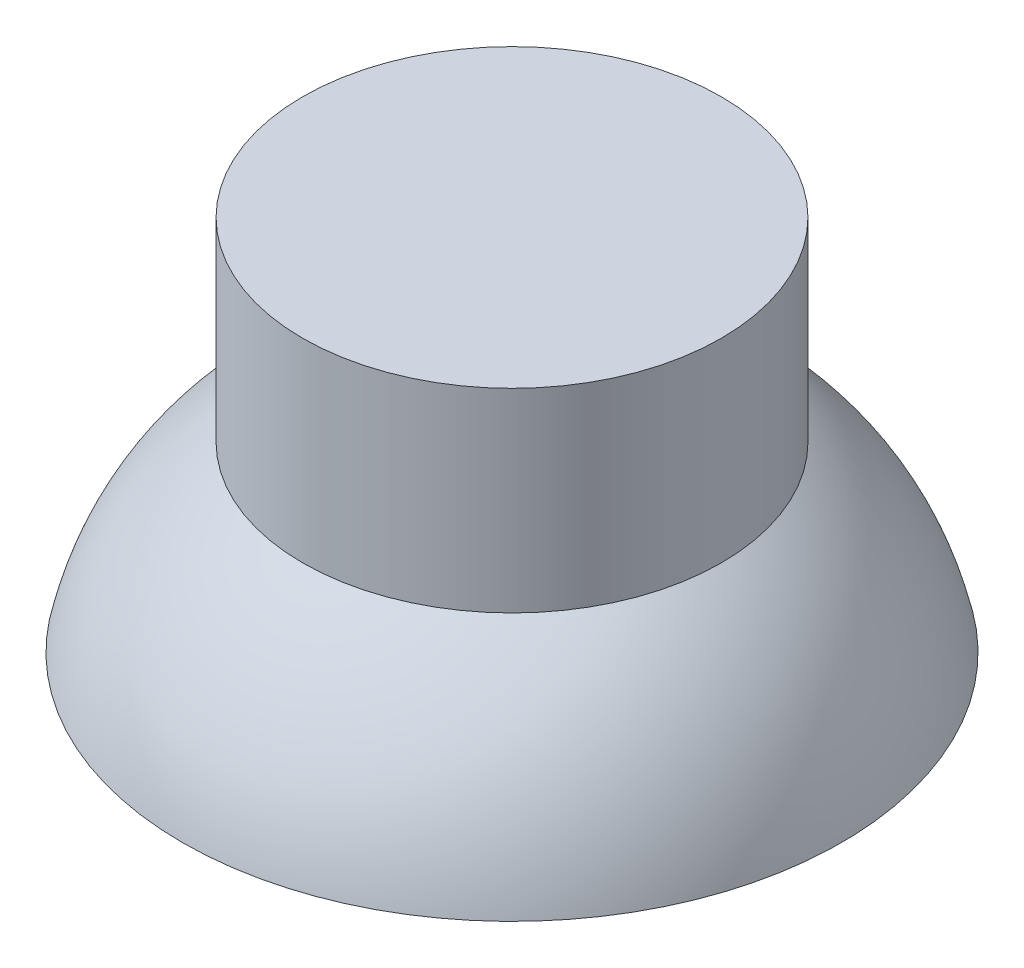
from build123d import *

# Parameters (mm, degrees)
EXTRUDE_START   = 1
SKETCH_5_R      = 5.25
EXTRUDE_2_DEPTH = 1


with BuildPart() as part:
    # 草图4 → 旋转1 (revolve)
    with BuildSketch(Plane.XY, mode=Mode.PRIVATE) as revolve_1_sk:
        with BuildLine():
            Line((-5.25, 1.232083698), (-4.25, 1.232083698))
            Line((-4.25, 1.232083698), (-4.25, -3.117916302))
            add(Edge.make_bspline(
                [(-7, -7.215756799), (-6.518434103, -4.584722436), (-4.25, -3.117916302)],
                knots=[0, 0, 0, 1, 1, 1], degree=2))
            Line((-7, -7.215756799), (-8.267671788, -7.215756799))
            add(Edge.make_bspline(
                [(-8.267671788, -7.215756799), (-7.63264977, -4.356571521), (-5.25, -2.648159382)],
                knots=[0, 0, 0, 1, 1, 1], degree=2))
            Line((-5.25, -2.648159382), (-5.25, 1.232083698))
        make_face()
    revolve(revolve_1_sk.sketch.rotate(Axis((0, 0, 0), (0, -1, 0)), 270), axis=Axis((0, 0, 0), (0, -1, 0)))

    # 草图5 → 凸台-拉伸2 (add)
    with BuildSketch(Plane(origin=(0, 1.232083698, 0), x_dir=(1, 0, 0), z_dir=(0, 1, 0)).offset(EXTRUDE_START)):
        with Locations(Location((0, 0, 0), (0, 0, 270))):
            Circle(SKETCH_5_R)
    extrude(amount=-EXTRUDE_2_DEPTH)


solid = part.part
